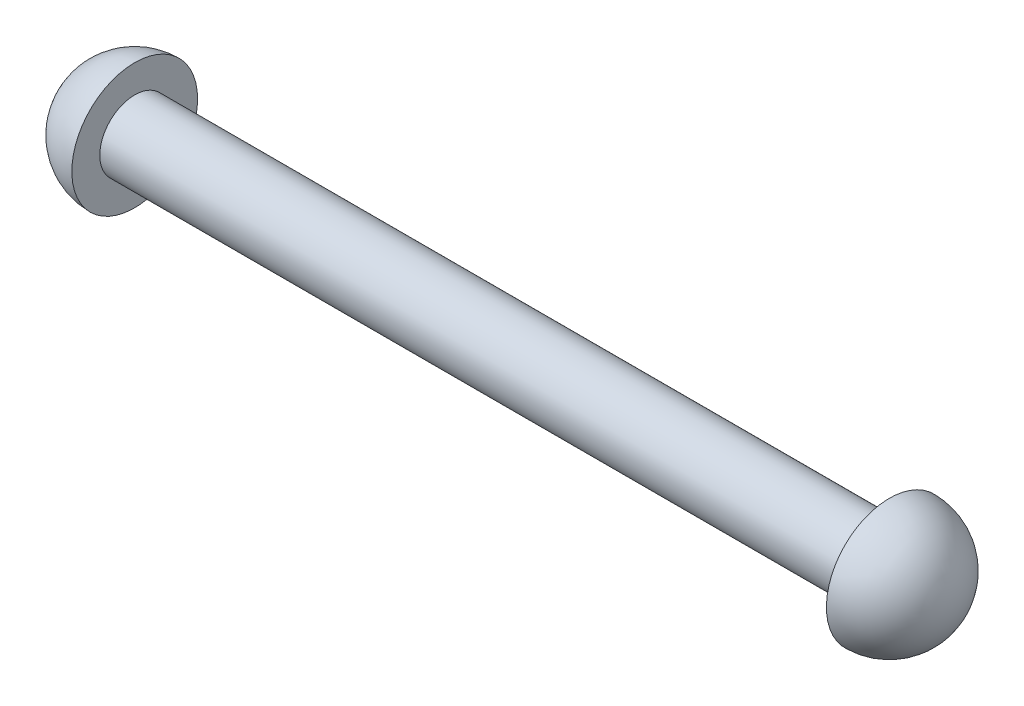
from build123d import *


with BuildPart() as part:
    # Sketch1 → Revolve1 (revolve)
    with BuildSketch(Plane.XY, mode=Mode.PRIVATE) as revolve1_sk:
        with BuildLine():
            Line((-34.29, 3.175), (34.29, 3.175))
            Line((34.29, 3.175), (34.29, 5.715))
            ThreePointArc((34.29, 5.715), (38.331115254, 4.041115254), (40.005, 0))
            Line((40.005, 0), (-40.005, 0))
            ThreePointArc((-40.005, 0), (-38.331115254, 4.041115254), (-34.29, 5.715))
            Line((-34.29, 5.715), (-34.29, 3.175))
        make_face()
    revolve(revolve1_sk.sketch.rotate(Axis((40.005, 0, 0), (-1, 0, 0)), 90), axis=Axis((40.005, 0, 0), (-1, 0, 0)))


solid = part.part
